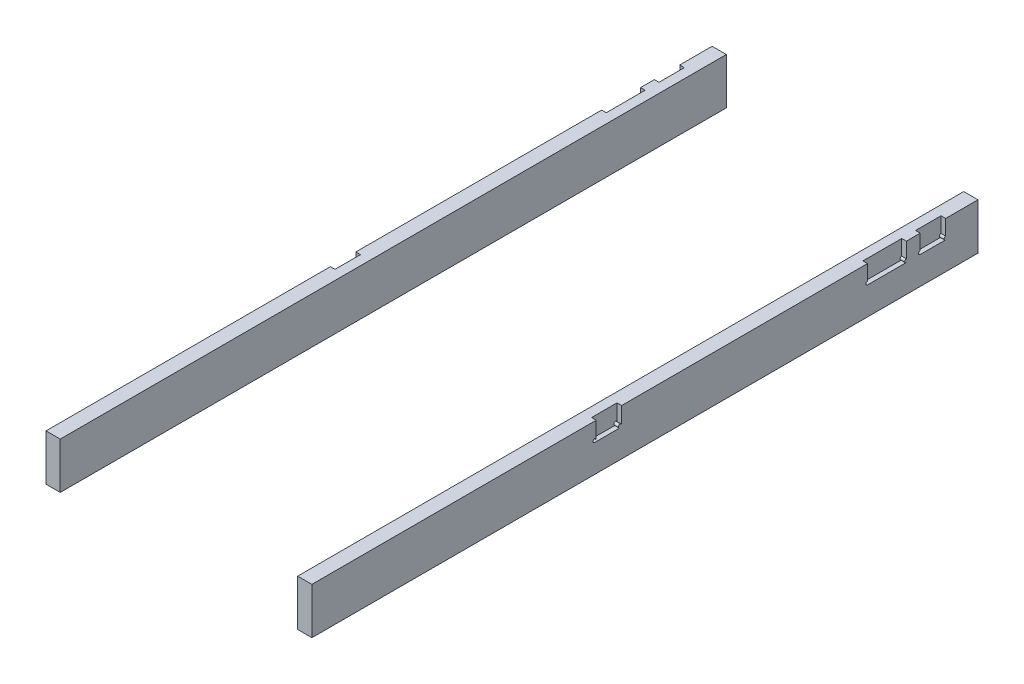
from build123d import *

# Parameters (mm, degrees)
SKETCH8_W           = 1440.8
SKETCH8_H           = 100
BOSS_EXTRUDE2_DEPTH = 30.8
CUT_EXTRUDE4_DEPTH  = 10
CUT_EXTRUDE5_DEPTH  = 10
CUT_EXTRUDE6_DEPTH  = 10
SKETCH16_W          = 1440.8
SKETCH16_H          = 100
BOSS_EXTRUDE3_DEPTH = 30.8
CUT_EXTRUDE7_DEPTH  = 10
CUT_EXTRUDE8_START  = -10
CUT_EXTRUDE8_DEPTH  = 10
CUT_EXTRUDE9_START  = -10
CUT_EXTRUDE9_DEPTH  = 10


with BuildPart() as part:
    # Sketch8 → Boss-Extrude2 (new body)
    with BuildSketch(Plane.ZY.offset(287.55)):
        with Locations((751.2, -450)):
            Rectangle(SKETCH8_W, SKETCH8_H)
    extrude(amount=-BOSS_EXTRUDE2_DEPTH)

    # Sketch9 → Cut-Extrude4 (cut)
    with BuildSketch(Plane.ZY.offset(287.55)):
        with BuildLine():
            Line((155.8, -433), (155.8, -400))
            Line((155.8, -400), (100.8, -400))
            Line((100.8, -400), (100.8, -433))
            ThreePointArc((100.8, -433), (97.3, -436.5), (100.8, -440))
            Line((100.8, -440), (155.8, -440))
            ThreePointArc((155.8, -440), (159.3, -436.5), (155.8, -433))
        make_face()
    extrude(amount=-CUT_EXTRUDE4_DEPTH, mode=Mode.SUBTRACT)

    # Sketch10 → Cut-Extrude5 (cut)
    with BuildSketch(Plane.ZY.offset(287.55)):
        with BuildLine():
            Line((269.79, -433), (269.79, -400))
            Line((269.79, -400), (185.8, -400))
            Line((185.8, -400), (185.8, -433))
            ThreePointArc((185.8, -433), (189.3, -436.5), (185.8, -440))
            Line((185.8, -440), (269.79, -440))
            ThreePointArc((269.79, -440), (273.29, -436.5), (269.79, -433))
        make_face()
    extrude(amount=-CUT_EXTRUDE5_DEPTH, mode=Mode.SUBTRACT)

    # Sketch11 → Cut-Extrude6 (cut)
    with BuildSketch(Plane.ZY.offset(287.55)):
        with BuildLine():
            Line((856.6, -433), (856.6, -400))
            Line((856.6, -400), (801.6, -400))
            Line((801.6, -400), (801.6, -433))
            ThreePointArc((801.6, -433), (805.1, -436.5), (801.6, -440))
            Line((801.6, -440), (856.6, -440))
            ThreePointArc((856.6, -440), (860.1, -436.5), (856.6, -433))
        make_face()
    extrude(amount=-CUT_EXTRUDE6_DEPTH, mode=Mode.SUBTRACT)


with BuildPart() as body_2:
    # Sketch16 → Boss-Extrude3 (new body)
    with BuildSketch(Plane(origin=(287.55, 0, 0), x_dir=(0, 0, -1), z_dir=(1, 0, 0))):
        with Locations((-751.2, -450)):
            Rectangle(SKETCH16_W, SKETCH16_H)
    extrude(amount=-BOSS_EXTRUDE3_DEPTH)

    # Sketch17 → Cut-Extrude7 (cut)
    with BuildSketch(Plane(origin=(287.55, 0, 0), x_dir=(0, 0, -1), z_dir=(1, 0, 0))):
        with BuildLine():
            Line((-856.6, -400), (-856.6, -436.47546134))
            ThreePointArc((-856.6, -436.47546134), (-862.583448285, -434.033817252), (-860.099913978, -440))
            Line((-860.099913978, -440), (-805.099913978, -440))
            ThreePointArc((-805.099913978, -440), (-807.583448285, -434.033817252), (-801.6, -436.47546134))
            Line((-801.6, -436.47546134), (-801.6, -400))
            Line((-801.6, -400), (-856.6, -400))
        make_face()
    extrude(amount=-CUT_EXTRUDE7_DEPTH, mode=Mode.SUBTRACT)

    # Sketch18 → Cut-Extrude8 (cut)
    with BuildSketch(Plane(origin=(287.55, 0, 0), x_dir=(0, 0, -1), z_dir=(1, 0, 0)).offset(CUT_EXTRUDE8_START)):
        with BuildLine():
            Line((-269.79, -400), (-269.79, -433))
            ThreePointArc((-269.79, -433), (-273.29, -436.5), (-269.79, -440))
            Line((-269.79, -440), (-185.8, -440))
            ThreePointArc((-185.8, -440), (-189.3, -436.5), (-185.8, -433))
            Line((-185.8, -433), (-185.8, -400))
            Line((-185.8, -400), (-269.79, -400))
        make_face()
    extrude(amount=CUT_EXTRUDE8_DEPTH, mode=Mode.SUBTRACT)

    # Sketch19 → Cut-Extrude9 (cut)
    with BuildSketch(Plane(origin=(287.55, 0, 0), x_dir=(0, 0, -1), z_dir=(1, 0, 0)).offset(CUT_EXTRUDE9_START)):
        with BuildLine():
            Line((-155.8, -400), (-155.8, -433))
            ThreePointArc((-155.8, -433), (-159.3, -436.5), (-155.8, -440))
            Line((-155.8, -440), (-100.8, -440))
            ThreePointArc((-100.8, -440), (-104.3, -436.5), (-100.8, -433))
            Line((-100.8, -433), (-100.8, -400))
            Line((-100.8, -400), (-155.8, -400))
        make_face()
    extrude(amount=CUT_EXTRUDE9_DEPTH, mode=Mode.SUBTRACT)


solid = Compound([part.part, body_2.part])
